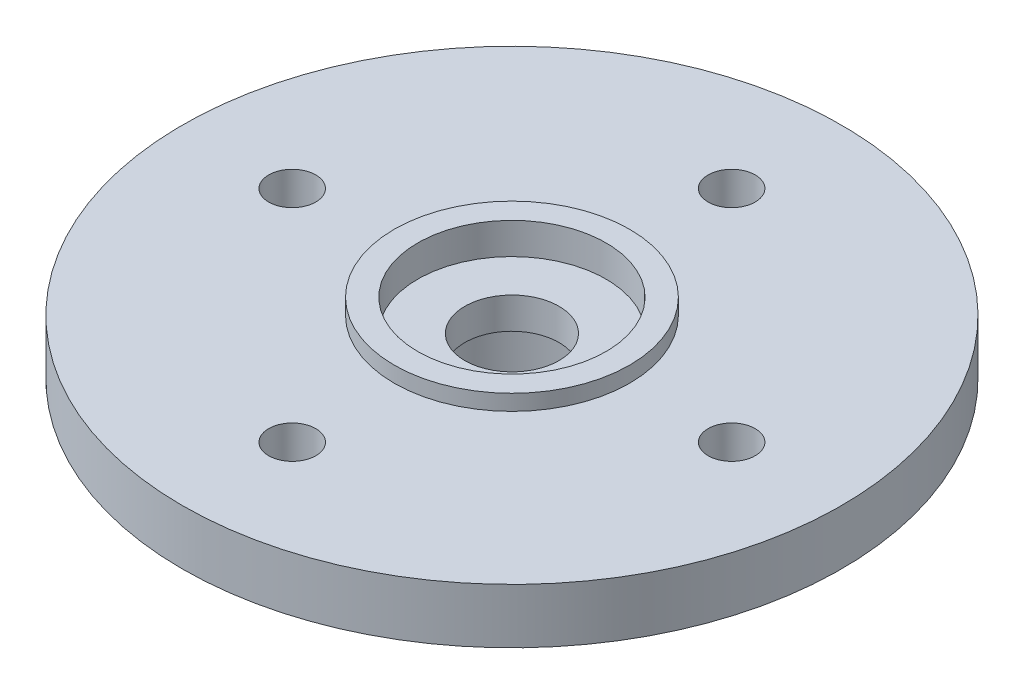
from build123d import *

# Parameters (mm, degrees)
ESQUISSE1_W                     = 10.5
ESQUISSE1_H                     = 1.75
ESQUISSE2_R                     = 4.45
BOSS_EXTRU_1_DEPTH              = 2.5
ESQUISSE3_R                     = 3.75
BOSS_EXTRU_2_DEPTH              = 0.5
DIAM_TRE_DU_PER_AGE_1_5_1_5_1_D = 1.5


with BuildPart() as part:
    # Esquisse1 → Révolution1 (revolve)
    with BuildSketch(Plane(origin=(0, 0, 0), x_dir=(-1, 0, 0), z_dir=(0, 0, -1)), mode=Mode.PRIVATE) as r_volution1_sk:
        with Locations((-5.25, -0.875)):
            Rectangle(ESQUISSE1_W, ESQUISSE1_H)
    revolve(r_volution1_sk.sketch.rotate(Axis((0, -1.75, 0), (0, 1, 0)), 270), axis=Axis((0, -1.75, 0), (0, 1, 0)))

    # Esquisse2 → Boss.-Extru.1 (add)
    with BuildSketch(Plane.XZ.offset(1.75)):
        with Locations(Location((0, 0, 0), (0, 0, 270))):
            Circle(ESQUISSE2_R)
    extrude(amount=BOSS_EXTRU_1_DEPTH)

    # Esquisse3 → Boss.-Extru.2 (add)
    with BuildSketch(Plane(origin=(0, 0, 0), x_dir=(-1, 0, 0), z_dir=(0, 1, 0))):
        with Locations(Location((0, 0, 0), (0, 0, 90))):
            Circle(ESQUISSE3_R)
    extrude(amount=BOSS_EXTRU_2_DEPTH)

    # Esquisse4 → Enlèvement de matière-Révolution1 (revolve, cut)
    with BuildSketch(Plane(origin=(0, 0, 0), x_dir=(-1, 0, 0), z_dir=(0, 0, -1)), mode=Mode.PRIVATE) as enl_vement_de_mati_re_r_volution1_sk:
        Polygon((-3, -4.5), (0, -4.5), (0, 0.5), (-3, 0.5), (-3, -0.5), (-1.500593113, -0.5), (-1.500593113, -1.5), (-3, -1.5), align=None)
    revolve(enl_vement_de_mati_re_r_volution1_sk.sketch.rotate(Axis((0, -4.5, 0), (0, 1, 0)), 270), axis=Axis((0, -4.5, 0), (0, 1, 0)), mode=Mode.SUBTRACT)

    # Diamètre du perçage Ø1.5 (1.5)1 (through all)
    with Locations(Plane(origin=(0, -1.75, 0), x_dir=(-1, 0, 0), z_dir=(0, -1, 0))):
        with Locations((-7, 0), (0, 7), (7, 0), (0, -7)):
            Hole(DIAM_TRE_DU_PER_AGE_1_5_1_5_1_D / 2)


solid = part.part
